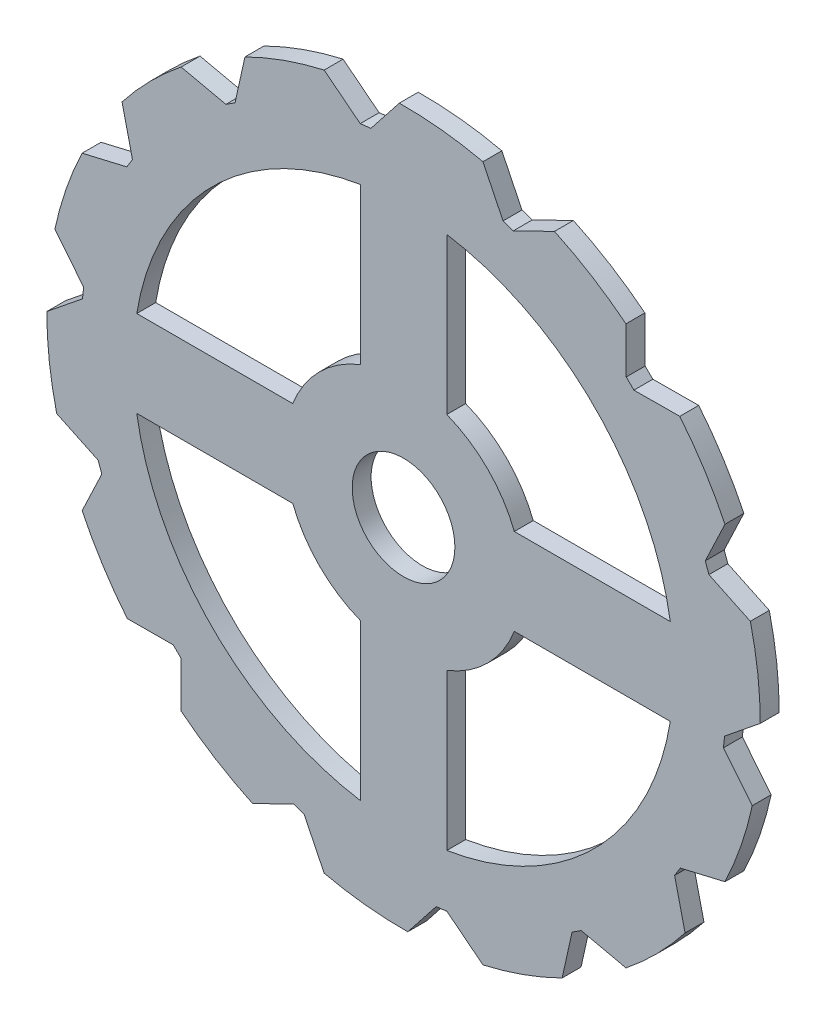
from build123d import *

# Parameters (mm, degrees)
SKETCH1_R           = 4.75
BOSS_EXTRUDE1_DEPTH = 1.75


with BuildPart() as part:
    # Sketch1 → Boss-Extrude1 (new body)
    with BuildSketch(Plane.XY):
        with BuildLine():
            Line((-29.69873918, 2.664897184), (-33, 0))
            ThreePointArc((-33, 0), (-32.769980082, -3.889525088), (-32.083126945, -7.724827859))
            Line((-32.083126945, -7.724827859), (-28.249774158, -9.542905528))
            Line((-28.249774158, -9.542905528), (-27.913894972, -10.484810604))
            Line((-27.913894972, -10.484810604), (-29.731972641, -14.318163391))
            ThreePointArc((-29.731972641, -14.318163391), (-27.837130167, -17.722702504), (-25.554221367, -20.880176492))
            Line((-25.554221367, -20.880176492), (-21.311655509, -20.854978431))
            Line((-21.311655509, -20.854978431), (-20.600361522, -21.557873064))
            Line((-20.600361522, -21.557873064), (-20.575163461, -25.800438921))
            ThreePointArc((-20.575163461, -25.800438921), (-17.390795223, -28.045681335), (-13.963988845, -29.899950092))
            Line((-13.963988845, -29.899950092), (-10.152502116, -28.036467086))
            Line((-10.152502116, -28.036467086), (-9.206673827, -28.361134373))
            Line((-9.206673827, -28.361134373), (-7.343190821, -32.172621102))
            ThreePointArc((-7.343190821, -32.172621102), (-3.5, -32.813869019), (0.391982924, -32.997671878))
            Line((0.391982924, -32.997671878), (3.017478833, -29.66498959))
            Line((3.017478833, -29.66498959), (4.010508532, -29.547125193))
            Line((4.010508532, -29.547125193), (7.343190821, -32.172621102))
            ThreePointArc((7.343190821, -32.172621102), (11.084013147, -31.082867509), (14.670317668, -29.559800059))
            Line((14.670317668, -29.559800059), (15.589811092, -25.417997089))
            Line((15.589811092, -25.417997089), (16.433360491, -24.880945498))
            Line((16.433360491, -24.880945498), (20.575163461, -25.800438921))
            ThreePointArc((20.575163461, -25.800438921), (23.472701554, -23.195522882), (26.043016078, -20.26724731))
            Line((26.043016078, -20.26724731), (25.074390068, -16.136658532))
            Line((25.074390068, -16.136658532), (25.601383863, -15.286789401))
            Line((25.601383863, -15.286789401), (29.731972641, -14.318163391))
            ThreePointArc((29.731972641, -14.318163391), (31.212333545, -10.714020473), (32.257575758, -6.960517671))
            Line((32.257575758, -6.960517671), (29.592678574, -3.659256851))
            Line((29.592678574, -3.659256851), (29.69873918, -2.664897184))
            Line((29.69873918, -2.664897184), (33, 0))
            ThreePointArc((33, 0), (32.769980082, 3.889525088), (32.083126945, 7.724827859))
            Line((32.083126945, 7.724827859), (28.249774158, 9.542905528))
            Line((28.249774158, 9.542905528), (27.913894972, 10.484810604))
            Line((27.913894972, 10.484810604), (29.731972641, 14.318163391))
            ThreePointArc((29.731972641, 14.318163391), (27.837130167, 17.722702504), (25.554221367, 20.880176492))
            Line((25.554221367, 20.880176492), (21.311655509, 20.854978431))
            Line((21.311655509, 20.854978431), (20.600361522, 21.557873064))
            Line((20.600361522, 21.557873064), (20.575163461, 25.800438921))
            ThreePointArc((20.575163461, 25.800438921), (17.390795223, 28.045681335), (13.963988845, 29.899950092))
            Line((13.963988845, 29.899950092), (10.152502116, 28.036467086))
            Line((10.152502116, 28.036467086), (9.206673827, 28.361134373))
            Line((9.206673827, 28.361134373), (7.343190821, 32.172621102))
            ThreePointArc((7.343190821, 32.172621102), (3.5, 32.813869019), (-0.391982924, 32.997671878))
            Line((-0.391982924, 32.997671878), (-3.017478833, 29.66498959))
            Line((-3.017478833, 29.66498959), (-4.010508532, 29.547125193))
            Line((-4.010508532, 29.547125193), (-7.343190821, 32.172621102))
            ThreePointArc((-7.343190821, 32.172621102), (-11.084013147, 31.082867509), (-14.670317668, 29.559800059))
            Line((-14.670317668, 29.559800059), (-15.589811092, 25.417997089))
            Line((-15.589811092, 25.417997089), (-16.433360491, 24.880945498))
            Line((-16.433360491, 24.880945498), (-20.575163461, 25.800438921))
            ThreePointArc((-20.575163461, 25.800438921), (-23.472701554, 23.195522882), (-26.043016078, 20.26724731))
            Line((-26.043016078, 20.26724731), (-25.074390068, 16.136658532))
            Line((-25.074390068, 16.136658532), (-25.601383863, 15.286789401))
            Line((-25.601383863, 15.286789401), (-29.731972641, 14.318163391))
            ThreePointArc((-29.731972641, 14.318163391), (-31.212333545, 10.714020473), (-32.257575758, 6.960517671))
            Line((-32.257575758, 6.960517671), (-29.592678574, 3.659256851))
            Line((-29.592678574, 3.659256851), (-29.69873918, 2.664897184))
        make_face()
        with BuildLine():
            Line((-24.677925359, -4), (-10.246950766, -4))
            ThreePointArc((-10.246950766, -4), (-7.778174593, -7.778174593), (-4, -10.246950766))
            Line((-4, -10.246950766), (-4, -24.677925359))
            ThreePointArc((-4, -24.677925359), (-17.67766953, -17.67766953), (-24.677925359, -4))
        make_face(mode=Mode.SUBTRACT)
        with BuildLine():
            Line((4, -24.677925359), (4, -10.246950766))
            ThreePointArc((4, -10.246950766), (7.778174593, -7.778174593), (10.246950766, -4))
            Line((10.246950766, -4), (24.677925359, -4))
            ThreePointArc((24.677925359, -4), (17.67766953, -17.67766953), (4, -24.677925359))
        make_face(mode=Mode.SUBTRACT)
        with BuildLine():
            Line((24.677925359, 4), (10.246950766, 4))
            ThreePointArc((10.246950766, 4), (7.778174593, 7.778174593), (4, 10.246950766))
            Line((4, 10.246950766), (4, 24.677925359))
            ThreePointArc((4, 24.677925359), (17.67766953, 17.67766953), (24.677925359, 4))
        make_face(mode=Mode.SUBTRACT)
        with BuildLine():
            Line((-4, 24.677925359), (-4, 10.246950766))
            ThreePointArc((-4, 10.246950766), (-7.778174593, 7.778174593), (-10.246950766, 4))
            Line((-10.246950766, 4), (-24.677925359, 4))
            ThreePointArc((-24.677925359, 4), (-17.67766953, 17.67766953), (-4, 24.677925359))
        make_face(mode=Mode.SUBTRACT)
        Circle(SKETCH1_R, mode=Mode.SUBTRACT)
    extrude(amount=BOSS_EXTRUDE1_DEPTH)


solid = part.part
